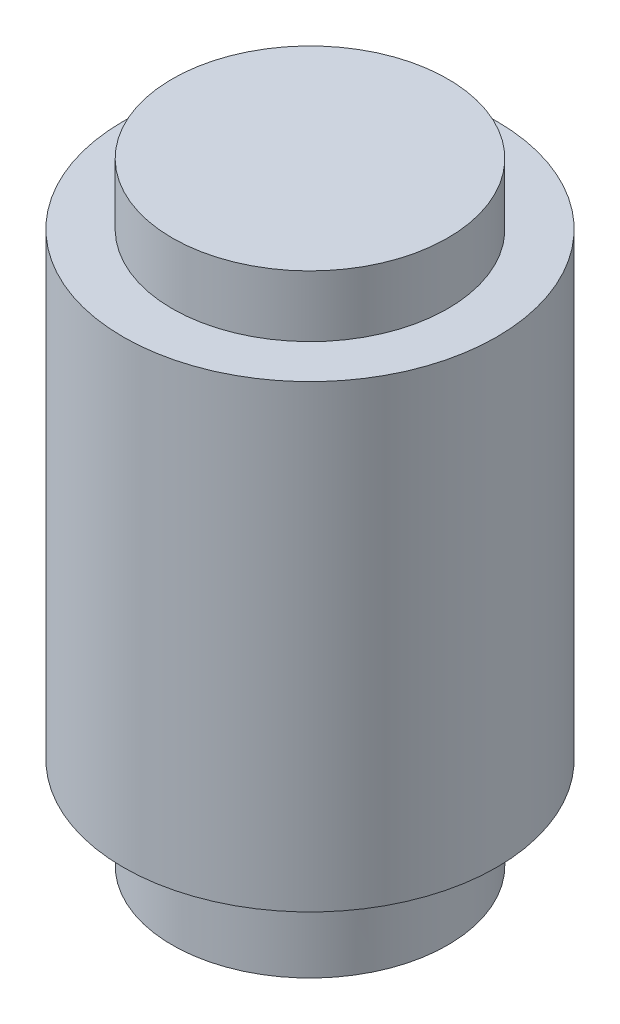
from build123d import *

# Parameters (mm, degrees)
CROQUIS1_R              = 22.5
SALIENTE_EXTRUIR1_DEPTH = 110
CROQUIS2_R              = 16.7
CROQUIS2_R_2            = 13.3
CORTAR_EXTRUIR1_DEPTH   = 90
CROQUIS4_R              = 22.5
CORTAR_EXTRUIR2_DEPTH   = 10
SALIENTE_EXTRUIR2_START = -75
CROQUIS5_R              = 30.5
CROQUIS5_R_2            = 22.5
SALIENTE_EXTRUIR2_DEPTH = 75


with BuildPart() as part:
    # Croquis1 → Saliente-Extruir1 (new body)
    with BuildSketch(Plane(origin=(0, 0, 0), x_dir=(1, 0, 0), z_dir=(0, 1, 0))):
        with Locations(Location((0, 0, 0), (0, 0, 270))):
            Circle(CROQUIS1_R)
    extrude(amount=SALIENTE_EXTRUIR1_DEPTH)

    # Croquis2 → Cortar-Extruir1 (cut)
    with BuildSketch(Plane.XZ):
        with Locations(Location((0, 0, 0), (0, 0, 270))):
            Circle(CROQUIS2_R)
        with Locations(Location((0, 0, 0), (0, 0, 270))):
            Circle(CROQUIS2_R_2, mode=Mode.SUBTRACT)
    extrude(amount=-CORTAR_EXTRUIR1_DEPTH, mode=Mode.SUBTRACT)

    # Croquis4 → Cortar-Extruir2 (cut)
    with BuildSketch(Plane.XZ):
        with Locations(Location((0, 0, 0), (0, 0, 270))):
            Circle(CROQUIS4_R)
    extrude(amount=-CORTAR_EXTRUIR2_DEPTH, mode=Mode.SUBTRACT)

    # Croquis5 → Saliente-Extruir2 (add)
    with BuildSketch(Plane(origin=(0, 100, 0), x_dir=(1, 0, 0), z_dir=(0, 1, 0)).offset(SALIENTE_EXTRUIR2_START)):
        with Locations(Location((0, 0, 0), (0, 0, 270))):
            Circle(CROQUIS5_R)
        with Locations(Location((0, 0, 0), (0, 0, 90))):
            Circle(CROQUIS5_R_2, mode=Mode.SUBTRACT)
    extrude(amount=SALIENTE_EXTRUIR2_DEPTH)


solid = part.part
